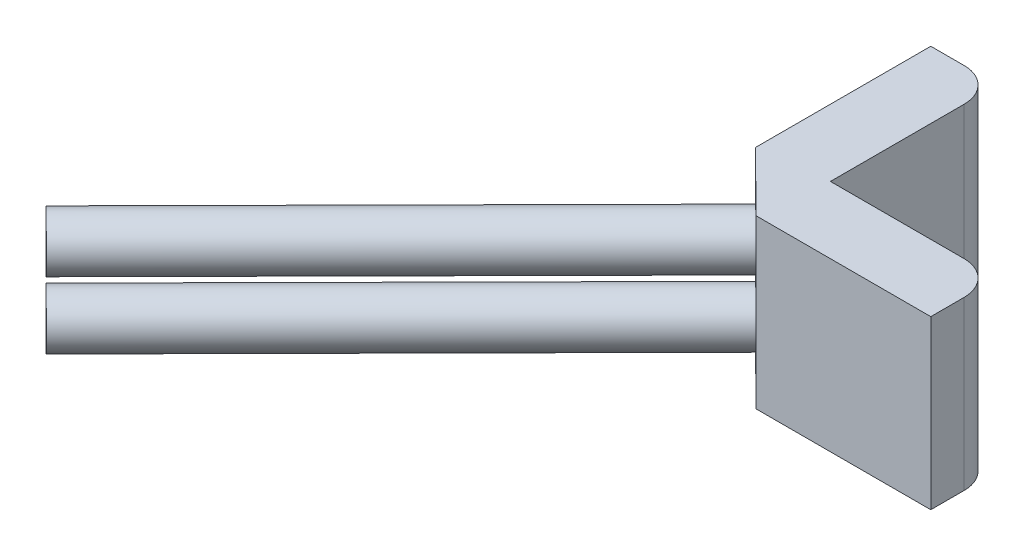
from build123d import *

# Parameters (mm, degrees)
BOSS_EXTRUDE1_DEPTH = 50
CUT_EXTRUDE1_DEPTH  = 50
SKETCH3_R           = 7.5
BOSS_EXTRUDE2_DEPTH = 150
FILLET1_R           = 10


with BuildPart() as part:
    # Sketch1 → Boss-Extrude1 (new body)
    with BuildSketch(Plane(origin=(0, 0, 0), x_dir=(1, 0, 0), z_dir=(0, 1, 0))):
        Polygon((0, 0), (0, 70), (20, 70), (20, 20), (70, 20), (70, 0), align=None)
    extrude(amount=BOSS_EXTRUDE1_DEPTH)

    # Sketch2 → Cut-Extrude1 (cut)
    with BuildSketch(Plane(origin=(0, 50, 0), x_dir=(1, 0, 0), z_dir=(0, 1, 0))):
        Polygon((0, 17.6), (17.754999296, 0), (0, 0), align=None)
    extrude(amount=-CUT_EXTRUDE1_DEPTH, mode=Mode.SUBTRACT)

    # Sketch3 → Boss-Extrude2 (add)
    with BuildSketch(Plane(origin=(8.799661731, 0, -8.8771584), x_dir=(0.7101999718389179, 0, 0.7040000000000001), z_dir=(-0.7040000000000001, 0, 0.7101999718389179))):
        with Locations((0.1096, 35)):
            Circle(SKETCH3_R)
        with Locations(Location((0.1096, 15, 0), (0, 0, 180))):
            Circle(SKETCH3_R)
    extrude(amount=BOSS_EXTRUDE2_DEPTH)

    # Fillet1
    fillet1_edges = [part.edges().sort_by_distance(p)[0] for p in [
        (20, 25, -70),
        (70, 25, -20),
    ]]
    fillet(fillet1_edges, radius=FILLET1_R)


solid = part.part
